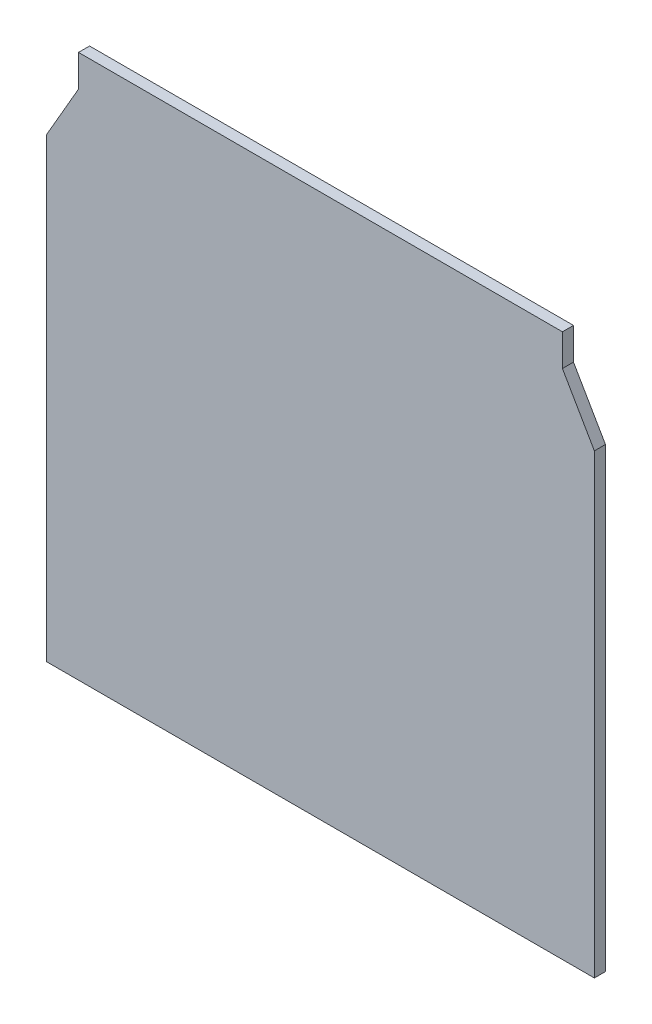
from build123d import *

# Parameters (mm, degrees)
EXTRUDE_1_DEPTH = 4


with BuildPart() as part:
    # 草图1 → 凸台-拉伸1 (new body)
    with BuildSketch(Plane.XY):
        Polygon((-99, 0), (99, 0), (99, 165), (87.452994616, 185), (87.452994616, 196.5), (-87.452994616, 196.5), (-87.452994616, 185), (-99, 165), align=None)
    extrude(amount=EXTRUDE_1_DEPTH)


solid = part.part
